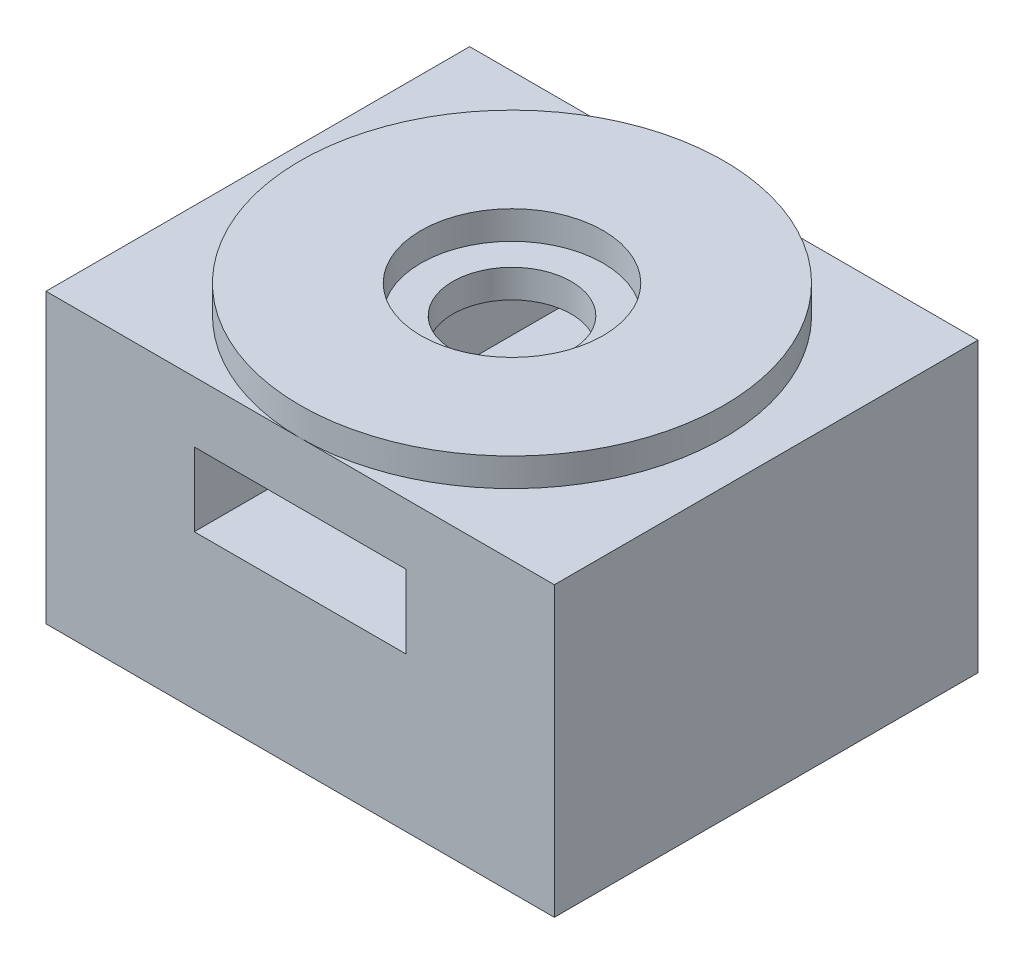
from build123d import *

# Parameters (mm, degrees)
BOSS_EXTRUDE1_DEPTH      = 5.1
BOSS_EXTRUDE1_DEPTH_BACK = 5.1
SKETCH1_W                = 18
SKETCH1_H                = 15
SKETCH1_R                = 2.1
CUT_EXTRUDE1_DEPTH       = 4.1
CUT_EXTRUDE1_DEPTH_BACK  = 4.1
SKETCH4_W                = 6.8
SKETCH4_H                = 7.2
CUT_EXTRUDE2_DEPTH       = 7.5
SKETCH6_R                = 4.9
CUT_EXTRUDE4_DEPTH       = 4.5
SKETCH7_R                = 7.5
SKETCH7_R_2              = 3.225
BOSS_EXTRUDE2_DEPTH      = 1
SKETCH8_W                = 7.5
SKETCH8_H                = 2.6
CUT_EXTRUDE5_DEPTH       = 6.5


with BuildPart() as part:
    # Sketch1 → Boss-Extrude1 (new, two sides: drawn at the far end of the back side and taken through both)
    with BuildSketch(Plane(origin=(0, 0, 0), x_dir=(1, 0, 0), z_dir=(0, 1, 0)).offset(-BOSS_EXTRUDE1_DEPTH_BACK)):
        Rectangle(SKETCH1_W, SKETCH1_H)
        with Locations(Location((0, 0, 0), (0, 0, 270))):
            Circle(SKETCH1_R, mode=Mode.SUBTRACT)
    extrude(amount=BOSS_EXTRUDE1_DEPTH + BOSS_EXTRUDE1_DEPTH_BACK)

    # Sketch4 → Cut-Extrude1 (cut, two sides: drawn at the far end of the back side and taken through both)
    with BuildSketch(Plane(origin=(0, 0, 0), x_dir=(1, 0, 0), z_dir=(0, 1, 0)).offset(-CUT_EXTRUDE1_DEPTH_BACK)):
        Rectangle(SKETCH4_W, SKETCH4_H)
    extrude(amount=CUT_EXTRUDE1_DEPTH + CUT_EXTRUDE1_DEPTH_BACK, mode=Mode.SUBTRACT)

    # Sketch5 → Cut-Extrude2 (cut)
    with BuildSketch(Plane(origin=(0, 0, -7.5), x_dir=(-1, 0, 0), z_dir=(0, 0, -1))):
        Polygon((1.75, -0.4), (4.9, -0.4), (4.9, 4.1), (-4.9, 4.1), (-4.9, -0.4), (-1.75, -0.4), (-1.75, -4.1), (1.75, -4.1), align=None)
    extrude(amount=-CUT_EXTRUDE2_DEPTH, mode=Mode.SUBTRACT)

    # Sketch6 → Cut-Extrude4 (cut)
    with BuildSketch(Plane.XZ.offset(-4.1)):
        Circle(SKETCH6_R)
    extrude(amount=CUT_EXTRUDE4_DEPTH, mode=Mode.SUBTRACT)

    # Sketch7 → Boss-Extrude2 (add)
    with BuildSketch(Plane(origin=(0, 5.1, 0), x_dir=(1, 0, 0), z_dir=(0, 1, 0))):
        with Locations(Location((0, 0, 0), (0, 0, 270))):
            Circle(SKETCH7_R)
        with Locations(Location((0, 0, 0), (0, 0, 270))):
            Circle(SKETCH7_R_2, mode=Mode.SUBTRACT)
    extrude(amount=BOSS_EXTRUDE2_DEPTH)

    # Sketch8 → Cut-Extrude5 (cut)
    with BuildSketch(Plane.XY.offset(7.5)):
        with Locations((0, 1.65)):
            Rectangle(SKETCH8_W, SKETCH8_H)
    extrude(amount=-CUT_EXTRUDE5_DEPTH, mode=Mode.SUBTRACT)


solid = part.part
